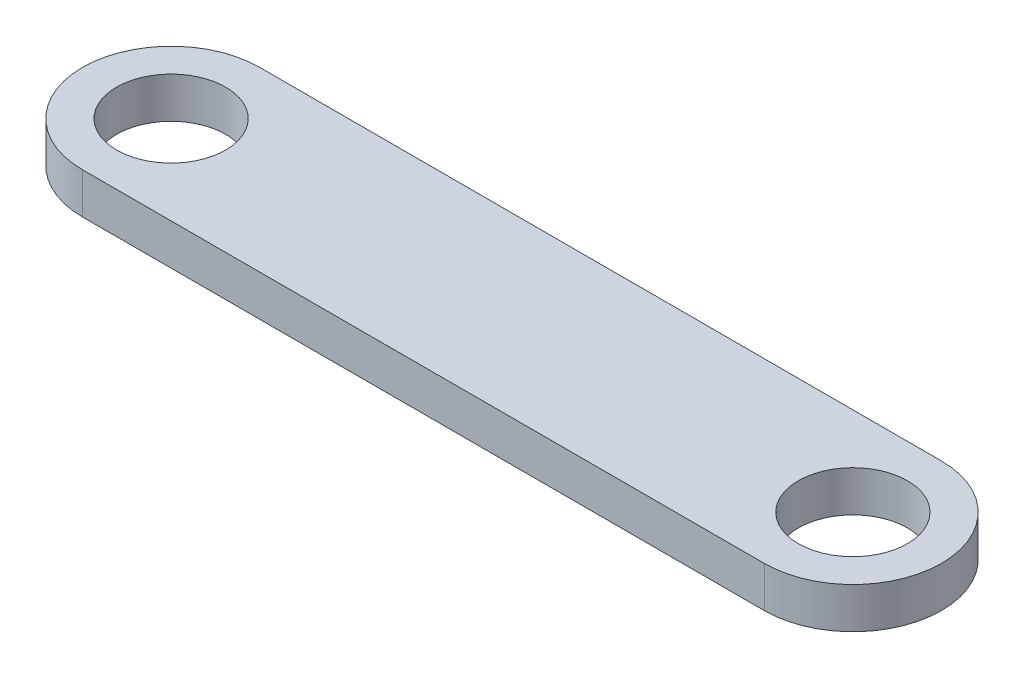
from build123d import *

# Parameters (mm, degrees)
SKETCH1_R           = 4
BOSS_EXTRUDE1_DEPTH = 3


with BuildPart() as part:
    # Sketch1 → Boss-Extrude1 (new body)
    with BuildSketch(Plane(origin=(0, 0, 0), x_dir=(1, 0, 0), z_dir=(0, 1, 0))):
        with BuildLine():
            Line((-25, 6.5), (25, 6.5))
            ThreePointArc((25, 6.5), (31.5, 0), (25, -6.5))
            Line((25, -6.5), (-25, -6.5))
            ThreePointArc((-25, -6.5), (-31.5, 0), (-25, 6.5))
        make_face()
        with Locations(Location((-25, 0, 0), (0, 0, 270))):
            Circle(SKETCH1_R, mode=Mode.SUBTRACT)
        with Locations(Location((25, 0, 0), (0, 0, 270))):
            Circle(SKETCH1_R, mode=Mode.SUBTRACT)
    extrude(amount=BOSS_EXTRUDE1_DEPTH)


solid = part.part
